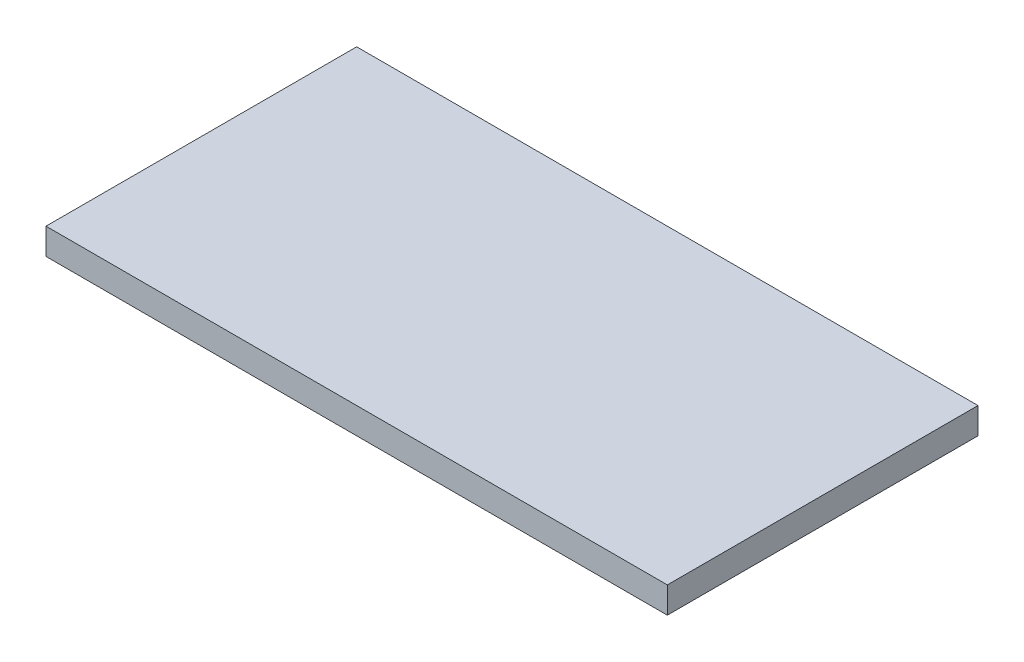
from build123d import *

# Parameters (mm, degrees)
SKETCH1_W           = 101.8
SKETCH1_H           = 50.9
BOSS_EXTRUDE1_DEPTH = 4.3


with BuildPart() as part:
    # Sketch1 → Boss-Extrude1 (new body)
    with BuildSketch(Plane(origin=(0, 0, 0), x_dir=(1, 0, 0), z_dir=(0, 1, 0))):
        Rectangle(SKETCH1_W, SKETCH1_H)
    extrude(amount=BOSS_EXTRUDE1_DEPTH)


solid = part.part
